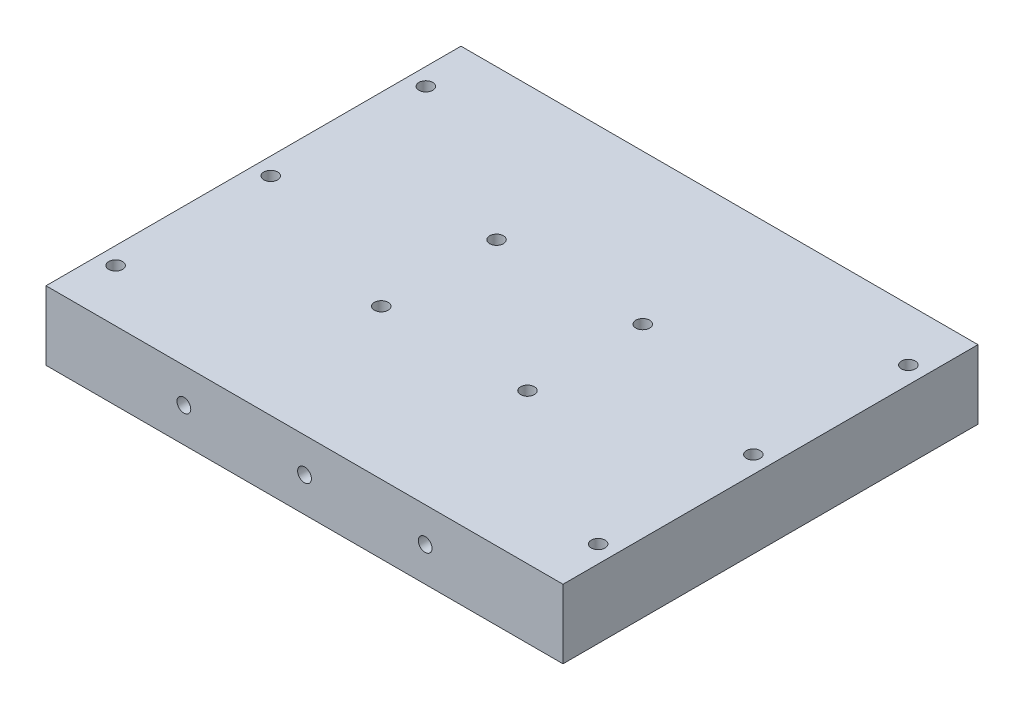
from build123d import *

# Parameters (mm, degrees)
SKETCH1_W                  = 150
SKETCH1_H                  = 120.4
BOSS_EXTRUDE2_DEPTH        = 20
SZKIC4_R                   = 2
WYTNIJ_WYCI_GNI_CIE2_DEPTH = 10
WYTNIJ_WYCI_GNI_CIE3_START = -10
SZKIC5_R                   = 2
WYTNIJ_WYCI_GNI_CIE3_DEPTH = 10
SZKIC1_R                   = 2
WYTNIJ_WYCI_GNI_CIE5_DEPTH = 10
SZKIC6_R                   = 2
WYTNIJ_WYCI_GNI_CIE6_DEPTH = 20


with BuildPart() as part:
    # Sketch1 → Boss-Extrude2 (new body)
    with BuildSketch(Plane(origin=(0, 0, 0), x_dir=(1, 0, 0), z_dir=(0, 1, 0))):
        with Locations((75, 60.2)):
            Rectangle(SKETCH1_W, SKETCH1_H)
    extrude(amount=BOSS_EXTRUDE2_DEPTH)

    # Szkic4 → Wytnij-wyciągnięcie2 (cut)
    with BuildSketch(Plane(origin=(0, 0, -120.4), x_dir=(-1, 0, 0), z_dir=(0, 0, -1))):
        with Locations((-40, 10)):
            Circle(SZKIC4_R)
        with Locations((-75, 10)):
            Circle(SZKIC4_R)
        with Locations((-110, 10)):
            Circle(SZKIC4_R)
    extrude(amount=-WYTNIJ_WYCI_GNI_CIE2_DEPTH, mode=Mode.SUBTRACT)

    # Szkic5 → Wytnij-wyciągnięcie3 (cut)
    with BuildSketch(Plane.XY.offset(WYTNIJ_WYCI_GNI_CIE3_START)):
        with Locations(Location((40, 10, 0), (0, 0, 180))):
            Circle(SZKIC5_R)
        with Locations(Location((75, 10, 0), (0, 0, 180))):
            Circle(SZKIC5_R)
        with Locations(Location((110, 10, 0), (0, 0, 180))):
            Circle(SZKIC5_R)
    extrude(amount=WYTNIJ_WYCI_GNI_CIE3_DEPTH, mode=Mode.SUBTRACT)

    # Szkic1 → Wytnij-wyciągnięcie5 (cut)
    with BuildSketch(Plane(origin=(0, 20, 0), x_dir=(1, 0, 0), z_dir=(0, 1, 0))):
        with Locations(Location((53.79, 76.92, 0), (0, 0, 270))):
            Circle(SZKIC1_R)
        with Locations(Location((96.21, 76.92, 0), (0, 0, 270))):
            Circle(SZKIC1_R)
        with Locations(Location((53.79, 43.48, 0), (0, 0, 270))):
            Circle(SZKIC1_R)
        with Locations(Location((96.21, 43.48, 0), (0, 0, 270))):
            Circle(SZKIC1_R)
    extrude(amount=-WYTNIJ_WYCI_GNI_CIE5_DEPTH, mode=Mode.SUBTRACT)

    # Szkic6 → Wytnij-wyciągnięcie6 (cut)
    with BuildSketch(Plane(origin=(0, 20, 0), x_dir=(1, 0, 0), z_dir=(0, 1, 0))):
        with Locations(Location((145, 105.2, 0), (0, 0, 270))):
            Circle(SZKIC6_R)
        with Locations(Location((145, 60.2, 0), (0, 0, 270))):
            Circle(SZKIC6_R)
        with Locations(Location((145, 15.2, 0), (0, 0, 270))):
            Circle(SZKIC6_R)
        with Locations(Location((5, 15.2, 0), (0, 0, 270))):
            Circle(SZKIC6_R)
        with Locations(Location((5, 60.2, 0), (0, 0, 270))):
            Circle(SZKIC6_R)
        with Locations(Location((5, 105.2, 0), (0, 0, 270))):
            Circle(SZKIC6_R)
    extrude(amount=-WYTNIJ_WYCI_GNI_CIE6_DEPTH, mode=Mode.SUBTRACT)


solid = part.part
